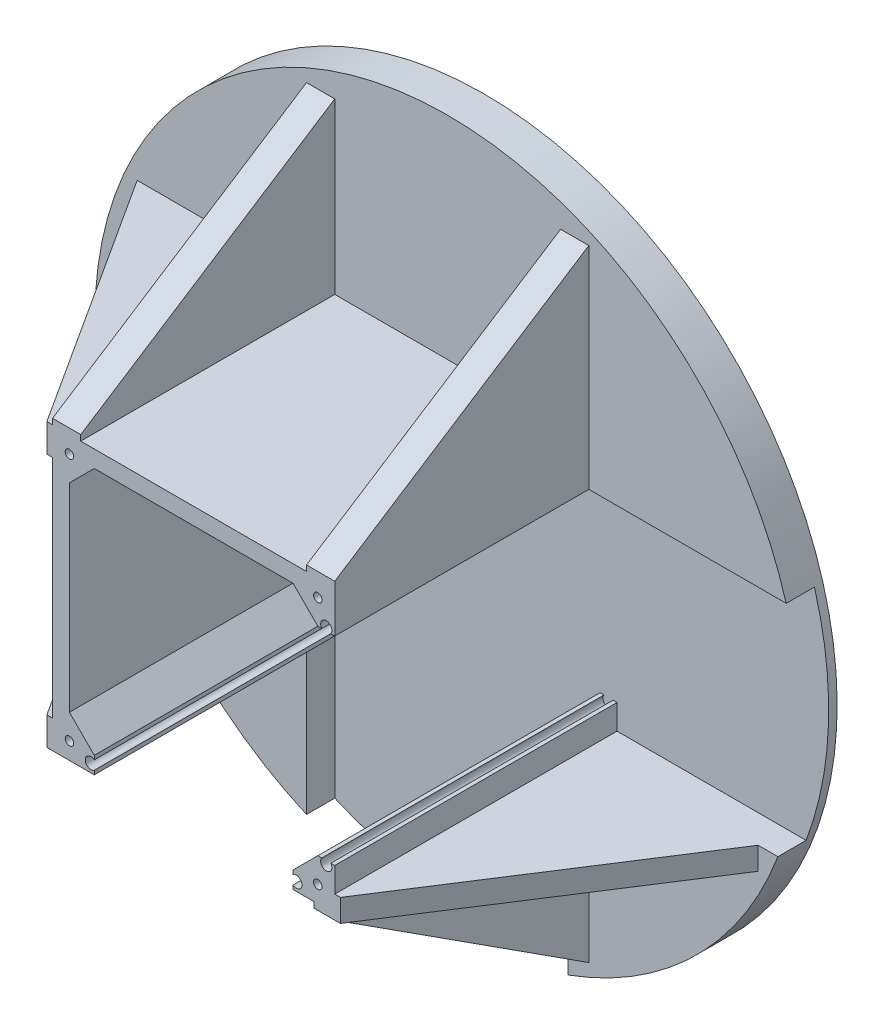
from build123d import *
from build123d.topology import SkipClean

# Parameters (mm, degrees)
EXTRUDE_2_DEPTH     = 50
CUT_EXTRUDE_1_DEPTH = 52
SKETCH_3_R          = 62.5
EXTRUDE_3_DEPTH     = 1.5
EXTRUDE_START       = 5
EXTRUDE_5_DEPTH     = 5
EXTRUDE_6_DEPTH     = 47
CUT_EXTRUDE_2_DEPTH = 50
EXTRUDE_7_REACH     = 132.126
SKETCH_12_R         = 0.75
CUT_EXTRUDE_3_DEPTH = 5


with BuildPart() as part:
    # 草图1 → 凸台-拉伸2 (new body)
    # profile 1 of 3: a face of its own
    with BuildSketch(Plane.XY):
        Polygon((-3, -40.842640687), (-3, -47), (3.157359313, -47), align=None)
    # profile 2 of 3: a face of its own
    with BuildSketch(Plane.XY):
        Polygon((-3, -3.157359313), (3.157359313, 3), (40.842640687, 3), (47, -3.157359313), (47, -40.842640687), (40.842640687, -47), (3.157359313, -47), (-3, -40.842640687), align=None)
        Polygon((0, -39.6), (4.4, -44), (39.6, -44), (44, -39.6), (44, -4.4), (39.6, 0), (4.4, 0), (0, -4.4), align=None, mode=Mode.SUBTRACT)
    # profile 3 of 3: a face of its own
    with BuildSketch(Plane.XY):
        Polygon((47, -47), (40.842640687, -47), (47, -40.842640687), align=None)
    extrude(amount=EXTRUDE_2_DEPTH)

    # 草图2 → 切除-拉伸1 (cut)
    with BuildSketch(Plane.XY.offset(50)):
        with BuildLine():
            ThreePointArc((4.8, -45.5), (4.694427191, -45.052786405), (4.4, -44.7))
            Line((4.4, -44.7), (4.4, -46.3))
            ThreePointArc((4.4, -46.3), (4.694427191, -45.947213595), (4.8, -45.5))
        make_face()
        with BuildLine():
            Line((4.4, -46.3), (4.4, -44.7))
            ThreePointArc((4.4, -44.7), (2.8, -45.5), (4.4, -46.3))
        make_face()
        with BuildLine():
            ThreePointArc((4.8, -45.5), (4.694427191, -45.052786405), (4.4, -44.7))
            Line((4.4, -44.7), (4.4, -46.3))
            ThreePointArc((4.4, -46.3), (4.694427191, -45.947213595), (4.8, -45.5))
        make_face()
        with BuildLine():
            Line((4.4, -46.3), (4.4, -44.7))
            ThreePointArc((4.4, -44.7), (2.8, -45.5), (4.4, -46.3))
        make_face()
        with BuildLine():
            Line((39.6, -44), (4.4, -44))
            Line((4.4, -44), (4.4, -44.7))
            ThreePointArc((4.4, -44.7), (4.694427191, -45.052786405), (4.8, -45.5))
            ThreePointArc((4.8, -45.5), (4.694427191, -45.947213595), (4.4, -46.3))
            Line((4.4, -46.3), (4.4, -47))
            Line((4.4, -47), (39.6, -47))
            Line((39.6, -47), (39.6, -46.3))
            ThreePointArc((39.6, -46.3), (39.2, -45.5), (39.6, -44.7))
            Line((39.6, -44.7), (39.6, -44))
        make_face()
        with BuildLine():
            ThreePointArc((41.2, -45.5), (40.647213595, -44.605572809), (39.6, -44.7))
            Line((39.6, -44.7), (39.6, -46.3))
            ThreePointArc((39.6, -46.3), (40.647213595, -46.394427191), (41.2, -45.5))
        make_face()
        with BuildLine():
            Line((39.6, -46.3), (39.6, -44.7))
            ThreePointArc((39.6, -44.7), (39.2, -45.5), (39.6, -46.3))
        make_face()
        with BuildLine():
            ThreePointArc((41.2, -45.5), (40.647213595, -44.605572809), (39.6, -44.7))
            Line((39.6, -44.7), (39.6, -46.3))
            ThreePointArc((39.6, -46.3), (40.647213595, -46.394427191), (41.2, -45.5))
        make_face()
        with BuildLine():
            Line((39.6, -46.3), (39.6, -44.7))
            ThreePointArc((39.6, -44.7), (39.2, -45.5), (39.6, -46.3))
        make_face()
    extrude(amount=-CUT_EXTRUDE_1_DEPTH, mode=Mode.SUBTRACT)

    # 草图3 → 凸台-拉伸3 (add)
    with BuildSketch(Plane(origin=(0, 0, 0), x_dir=(-1, 0, 0), z_dir=(0, 0, -1))):
        with Locations((-22, -22)):
            Circle(SKETCH_3_R)
    extrude(amount=EXTRUDE_3_DEPTH)

    # 草图4 → 凸台-拉伸5 (add)
    with SkipClean():  # the faces are left unmerged after this step: merging them gives an invalid solid
        with BuildSketch(Plane.XY.offset(EXTRUDE_START)):
            with BuildLine():
                Line((-3, -79.282196187), (-3, -47))
                Line((-3, -47), (-3, -3.157359313))
                Line((-3, -3.157359313), (3.157359313, 3))
                Line((3.157359313, 3), (40.842640687, 3))
                Line((40.842640687, 3), (47, -3.157359313))
                Line((47, -3.157359313), (47, -4.4))
                Line((47, -4.4), (81.970742867, -4.4))
                ThreePointArc((81.970742867, -4.4), (-19.322802913, 24.890041154), (-3, -79.282196187))
            make_face()
            with BuildLine():
                Line((43.3, -47), (43.3, -80.758488748))
                ThreePointArc((43.3, -80.758488748), (65.929564348, -66.457208372), (80.5, -44))
                Line((80.5, -44), (47, -44))
                Line((47, -44), (47, -47))
                Line((47, -47), (43.3, -47))
            make_face()
        extrude(amount=-EXTRUDE_5_DEPTH)

    # 草图8 → 凸台-拉伸6 (add)
    with SkipClean():  # the faces are left unmerged after this step: merging them gives an invalid solid
        with BuildSketch(Plane.XY.offset(50)):
            Polygon((47, 3), (47, -3.157359313), (40.842640687, 3), align=None)
        extrude(amount=-EXTRUDE_6_DEPTH)

    # 草图9 → 切除-拉伸2 (cut)
    with SkipClean():  # the faces are left unmerged after this step: merging them gives an invalid solid
        with BuildSketch(Plane.XY.offset(50)):
            with BuildLine():
                Line((44, -4.4), (44, -39.6))
                Line((44, -39.6), (44.7, -39.6))
                ThreePointArc((44.7, -39.6), (45.5, -39.2), (46.3, -39.6))
                Line((46.3, -39.6), (47, -39.6))
                Line((47, -39.6), (47, -4.4))
                Line((47, -4.4), (46.3, -4.4))
                ThreePointArc((46.3, -4.4), (45.5, -4.8), (44.7, -4.4))
                Line((44.7, -4.4), (44, -4.4))
            make_face()
            with BuildLine():
                ThreePointArc((46.5, -3.8), (45.183772234, -2.851316702), (44.7, -4.4))
                Line((44.7, -4.4), (46.3, -4.4))
                ThreePointArc((46.3, -4.4), (46.448683298, -4.116227766), (46.5, -3.8))
            make_face()
            with BuildLine():
                Line((46.3, -4.4), (44.7, -4.4))
                ThreePointArc((44.7, -4.4), (45.5, -4.8), (46.3, -4.4))
            make_face()
            with BuildLine():
                ThreePointArc((46.5, -3.8), (45.183772234, -2.851316702), (44.7, -4.4))
                Line((44.7, -4.4), (46.3, -4.4))
                ThreePointArc((46.3, -4.4), (46.448683298, -4.116227766), (46.5, -3.8))
            make_face()
            with BuildLine():
                Line((46.3, -4.4), (44.7, -4.4))
                ThreePointArc((44.7, -4.4), (45.5, -4.8), (46.3, -4.4))
            make_face()
            with BuildLine():
                ThreePointArc((46.3, -39.6), (45.5, -39.2), (44.7, -39.6))
                Line((44.7, -39.6), (46.3, -39.6))
            make_face()
            with BuildLine():
                Line((46.3, -39.6), (44.7, -39.6))
                ThreePointArc((44.7, -39.6), (45.183772234, -41.148683298), (46.5, -40.2))
                ThreePointArc((46.5, -40.2), (46.448683298, -39.883772234), (46.3, -39.6))
            make_face()
            with BuildLine():
                ThreePointArc((46.3, -39.6), (45.5, -39.2), (44.7, -39.6))
                Line((44.7, -39.6), (46.3, -39.6))
            make_face()
            with BuildLine():
                Line((46.3, -39.6), (44.7, -39.6))
                ThreePointArc((44.7, -39.6), (45.183772234, -41.148683298), (46.5, -40.2))
                ThreePointArc((46.5, -40.2), (46.448683298, -39.883772234), (46.3, -39.6))
            make_face()
        extrude(amount=-CUT_EXTRUDE_2_DEPTH, mode=Mode.SUBTRACT)

    # 草图11 → 凸台-拉伸7 (add, up to next)
    with BuildSketch(Plane.XY.offset(50), mode=Mode.PRIVATE) as extrude_7_sk1:
        Polygon((-3, 3), (3.157359313, 3), (-3, -3.157359313), align=None)
    extrude_7_tool1 = extrude(extrude_7_sk1.sketch, amount=-EXTRUDE_7_REACH, mode=Mode.PRIVATE) - part.part
    add(extrude_7_tool1.solids().sort_by_distance((-0.947547, 0.947547, 50))[0])

    # 草图12 → 切除-拉伸3 (cut)
    with SkipClean():  # the faces are left unmerged after this step: merging them gives an invalid solid
        with BuildSketch(Plane.XY.offset(50)):
            Circle(SKETCH_12_R)
            with Locations((44, 0)):
                Circle(SKETCH_12_R)
            with Locations(Location((0, -44, 0), (0, 0, 180))):
                Circle(SKETCH_12_R)
            with Locations(Location((44, -44, 0), (0, 0, 180))):
                Circle(SKETCH_12_R)
        extrude(amount=-CUT_EXTRUDE_3_DEPTH, mode=Mode.SUBTRACT)

    # 草图14 → 放样3 section 0
    with SkipClean():  # the faces are left unmerged after this step: merging them gives an invalid solid
        with BuildSketch(Plane.XY.offset(50)):
            with BuildLine():
                Line((43.3, -47), (47, -47))
                Line((47, -47), (47, -48))
                Line((47, -48), (43.3, -48))
                Line((43.3, -48), (43.3, -47))
            make_face()
        # 草图13 → 放样3 section 1
        with BuildSketch(Plane.XY.offset(5)):
            with BuildLine():
                Line((47, -47), (43.3, -47))
                Line((43.3, -47), (43.3, -77))
                Line((43.3, -77), (47, -77))
                Line((47, -77), (47, -47))
            make_face()
        loft()

    # 草图15 → 放样4 section 0
    with SkipClean():  # the faces are left unmerged after this step: merging them gives an invalid solid
        with BuildSketch(Plane.XY.offset(5)):
            with BuildLine():
                Line((47, -44), (77, -44))
                Line((77, -44), (77, -48))
                Line((77, -48), (47, -48))
                Line((47, -48), (47, -44))
            make_face()
        # 草图16 → 放样4 section 1
        with BuildSketch(Plane.XY.offset(50)):
            with BuildLine():
                Line((47, -48), (48, -48))
                Line((48, -48), (48, -44))
                Line((48, -44), (47, -44))
                Line((47, -44), (47, -48))
            make_face()
        loft()

    # 草图18 → 放样5 section 0
    with SkipClean():  # the faces are left unmerged after this step: merging them gives an invalid solid
        with BuildSketch(Plane.XY.offset(50)):
            with BuildLine():
                Line((-3, 3), (-4, 3))
                Line((-4, 3), (-4, -2))
                Line((-4, -2), (-3, -2))
                Line((-3, -2), (-3, 3))
            make_face()
        # 草图17 → 放样5 section 1
        with BuildSketch(Plane.XY.offset(5)):
            with BuildLine():
                Line((-3, 3), (-33, 3))
                Line((-33, 3), (-33, -2))
                Line((-33, -2), (-3, -2))
                Line((-3, -2), (-3, 3))
            make_face()
        loft()

    # 草图20 → 放样6 section 0
    with SkipClean():  # the faces are left unmerged after this step: merging them gives an invalid solid
        with BuildSketch(Plane.XY.offset(50)):
            with BuildLine():
                Line((42, 3), (47, 3))
                Line((47, 3), (47, 4))
                Line((47, 4), (42, 4))
                Line((42, 4), (42, 3))
            make_face()
        # 草图19 → 放样6 section 1
        with BuildSketch(Plane.XY.offset(5)):
            with BuildLine():
                Line((47, 3), (42, 3))
                Line((42, 3), (42, 33))
                Line((42, 33), (47, 33))
                Line((47, 33), (47, 3))
            make_face()
        loft()

    # 草图22 → 放样7 section 0
    with SkipClean():  # the faces are left unmerged after this step: merging them gives an invalid solid
        with BuildSketch(Plane.XY.offset(50)):
            with BuildLine():
                Line((-3, -47), (-4, -47))
                Line((-4, -47), (-4, -42))
                Line((-4, -42), (-3, -42))
                Line((-3, -42), (-3, -47))
            make_face()
        # 草图21 → 放样7 section 1
        with BuildSketch(Plane.XY.offset(5)):
            with BuildLine():
                Line((-3, -47), (-33, -47))
                Line((-33, -47), (-33, -42))
                Line((-33, -42), (-3, -42))
                Line((-3, -42), (-3, -47))
            make_face()
        loft()

    # 草图24 → 放样9 section 0
    with SkipClean():  # the faces are left unmerged after this step: merging them gives an invalid solid
        with BuildSketch(Plane.XY.offset(50)):
            with BuildLine():
                Line((-3, 3), (2, 3))
                Line((2, 3), (2, 4))
                Line((2, 4), (-3, 4))
                Line((-3, 4), (-3, 3))
            make_face()
        # 草图23 → 放样9 section 1
        with BuildSketch(Plane.XY.offset(5)):
            with BuildLine():
                Line((-3, 3), (2, 3))
                Line((2, 3), (2, 33))
                Line((2, 33), (-3, 33))
                Line((-3, 33), (-3, 3))
            make_face()
        loft()


solid = part.part
